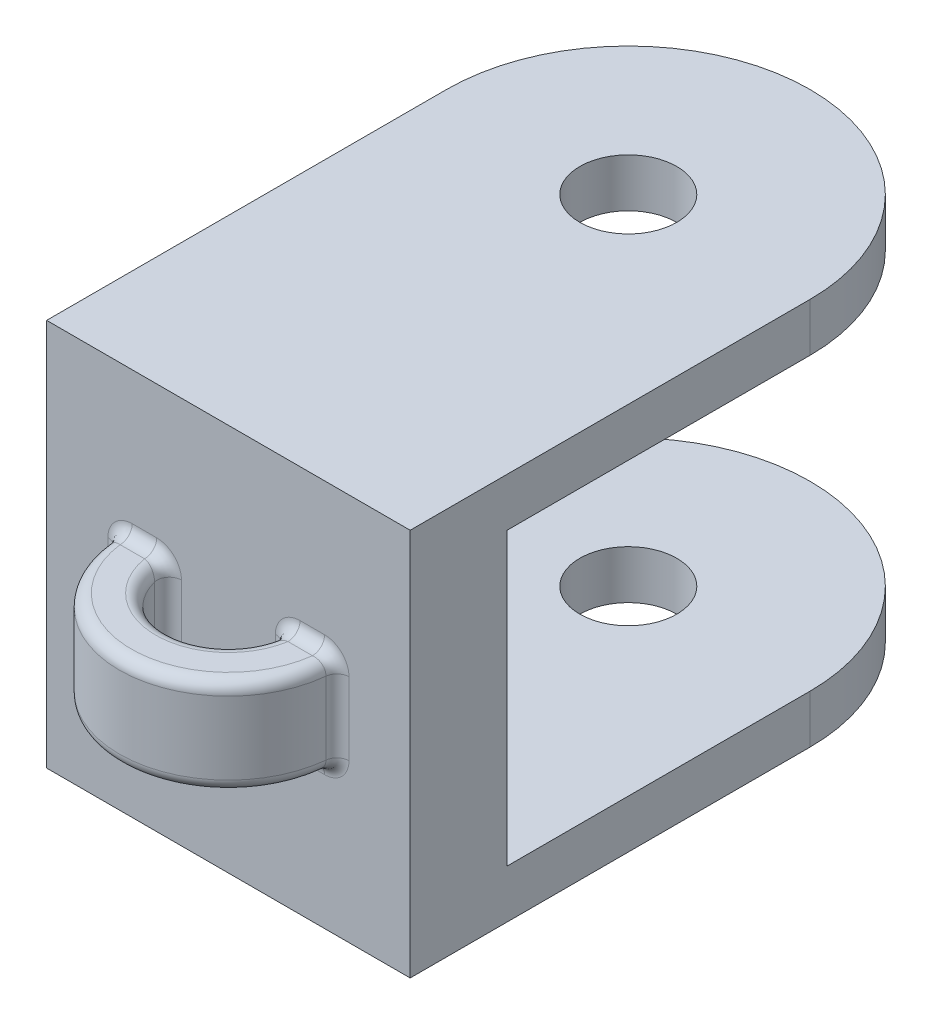
from build123d import *

# Parameters (mm, degrees)
BOSS_EXTRUDE1_START = 12
SKETCH1_R           = 4
BOSS_EXTRUDE1_DEPTH = 4
BOSS_EXTRUDE2_START = -12
SKETCH1_2_R         = 4
BOSS_EXTRUDE2_DEPTH = 4
SKETCH2_W           = 30
SKETCH2_H           = 32
BOSS_EXTRUDE3_DEPTH = 8
BOSS_EXTRUDE4_START = -12
BOSS_EXTRUDE4_DEPTH = 8
FILLET1_R           = 1


with BuildPart() as part:
    # Sketch1 → Boss-Extrude1 (new body)
    with BuildSketch(Plane(origin=(0, 0, 0), x_dir=(1, 0, 0), z_dir=(0, 1, 0)).offset(BOSS_EXTRUDE1_START)):
        with BuildLine():
            Line((-15, 0), (-15, -25))
            Line((-15, -25), (15, -25))
            Line((15, -25), (15, 0))
            ThreePointArc((15, 0), (0, 15), (-15, 0))
        make_face()
        Circle(SKETCH1_R, mode=Mode.SUBTRACT)
    extrude(amount=BOSS_EXTRUDE1_DEPTH)



with BuildPart() as body_2:
    # Sketch1<2> → Boss-Extrude2 (new body)
    with BuildSketch(Plane(origin=(0, 0, 0), x_dir=(1, 0, 0), z_dir=(0, 1, 0)).offset(BOSS_EXTRUDE2_START)):
        with BuildLine():
            Line((-15, 0), (-15, -25))
            Line((-15, -25), (15, -25))
            Line((15, -25), (15, 0))
            ThreePointArc((15, 0), (0, 15), (-15, 0))
        make_face()
        Circle(SKETCH1_2_R, mode=Mode.SUBTRACT)
    extrude(amount=-BOSS_EXTRUDE2_DEPTH)


with BuildPart() as part_1:
    add(part.part)

    add(body_2.part)  # Boss-Extrude3 merges body 2
    # Sketch2 → Boss-Extrude3 (add)
    with BuildSketch(Plane.XY.offset(25)):
        Rectangle(SKETCH2_W, SKETCH2_H)
    extrude(amount=BOSS_EXTRUDE3_DEPTH)

    # Sketch3 → Boss-Extrude4 (add)
    with BuildSketch(Plane.XZ.offset(16).offset(BOSS_EXTRUDE4_START)):
        with BuildLine():
            ThreePointArc((9, 33), (0, 42), (-9, 33))
            Line((-9, 33), (-5, 33))
            ThreePointArc((-5, 33), (0, 38), (5, 33))
            Line((5, 33), (9, 33))
        make_face()
    extrude(amount=-BOSS_EXTRUDE4_DEPTH)

    # Fillet1
    fillet1_edges = [part_1.edges().sort_by_distance(p)[0] for p in [
        (-9, 0, 33),
        (0, 4, 42),
        (9, 0, 33),
        (0, -4, 42),
        (0, -4, 38),
        (0, 4, 38),
        (-7, -4, 33),
        (-7, 4, 33),
        (7, 4, 33),
        (7, -4, 33),
        (5, 0, 33),
        (-5, 0, 33),
    ]]
    fillet(fillet1_edges, radius=FILLET1_R)


solid = part_1.part
